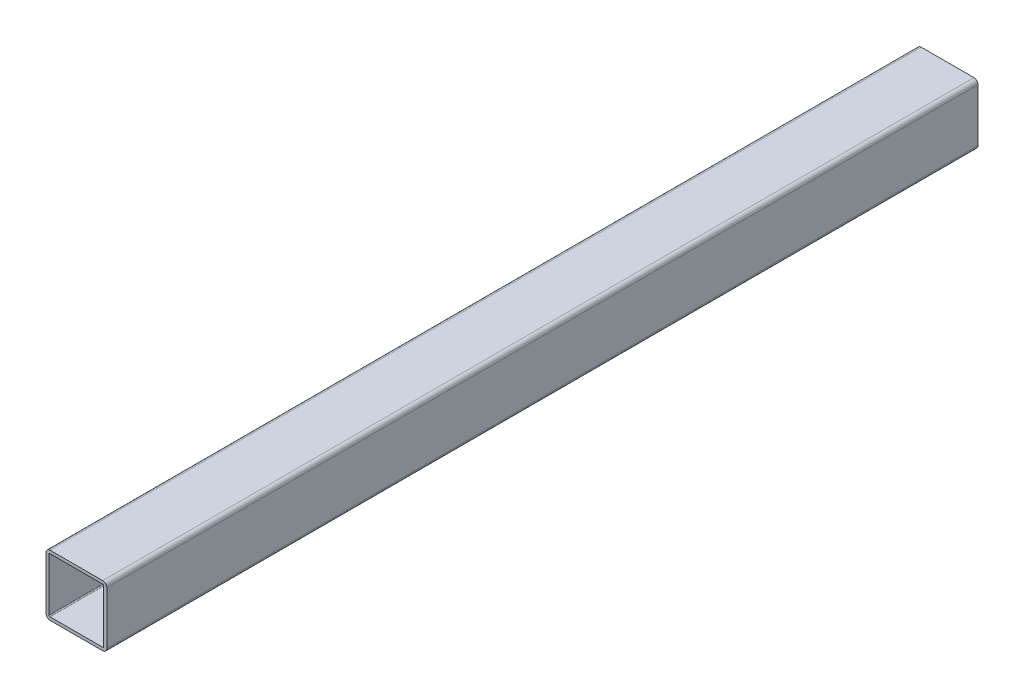
from build123d import *

# Parameters (mm, degrees)
EXTRUDE_1_DEPTH = 430


with BuildPart() as part:
    # Эскиз1 → Вытянуть-Тонкостенный1 (new body)
    with BuildSketch(Plane.XY):
        with BuildLine():
            Line((0, 28), (0, 2))
            ThreePointArc((0, 2), (0.585786438, 0.585786438), (2, 0))
            Line((2, 0), (28, 0))
            ThreePointArc((28, 0), (29.414213562, 0.585786438), (30, 2))
            Line((30, 2), (30, 28))
            ThreePointArc((30, 28), (29.414213562, 29.414213562), (28, 30))
            Line((28, 30), (2, 30))
            ThreePointArc((2, 30), (0.585786438, 29.414213562), (0, 28))
        make_face()
        with BuildLine():
            Line((1.5, 28), (1.5, 2))
            ThreePointArc((1.5, 2), (1.646446609, 1.646446609), (2, 1.5))
            Line((2, 1.5), (28, 1.5))
            ThreePointArc((28, 1.5), (28.353553391, 1.646446609), (28.5, 2))
            Line((28.5, 2), (28.5, 28))
            ThreePointArc((28.5, 28), (28.353553391, 28.353553391), (28, 28.5))
            Line((28, 28.5), (2, 28.5))
            ThreePointArc((2, 28.5), (1.646446609, 28.353553391), (1.5, 28))
        make_face(mode=Mode.SUBTRACT)
    extrude(amount=EXTRUDE_1_DEPTH)


solid = part.part
